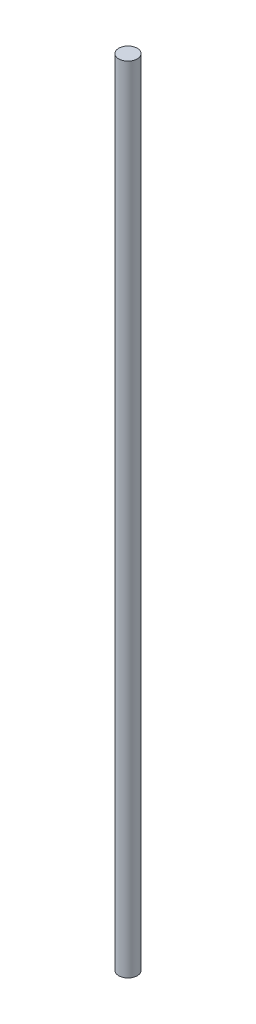
from build123d import *

# Parameters (mm, degrees)
SKETCH1_R           = 3.5
BOSS_EXTRUDE1_DEPTH = 300
SKETCH2_R           = 2.5
CUT_EXTRUDE1_DEPTH  = 11


with BuildPart() as part:
    # Sketch1 → Boss-Extrude1 (new body)
    with BuildSketch(Plane(origin=(0, 0, 0), x_dir=(1, 0, 0), z_dir=(0, 1, 0))):
        with Locations(Location((0, 0, 0), (0, 0, 270))):
            Circle(SKETCH1_R)
    extrude(amount=BOSS_EXTRUDE1_DEPTH)

    # Sketch2 → Cut-Extrude1 (cut)
    with BuildSketch(Plane.XZ):
        with Locations(Location((0, 0, 0), (0, 0, 270))):
            Circle(SKETCH2_R)
    extrude(amount=-CUT_EXTRUDE1_DEPTH, mode=Mode.SUBTRACT)


solid = part.part
